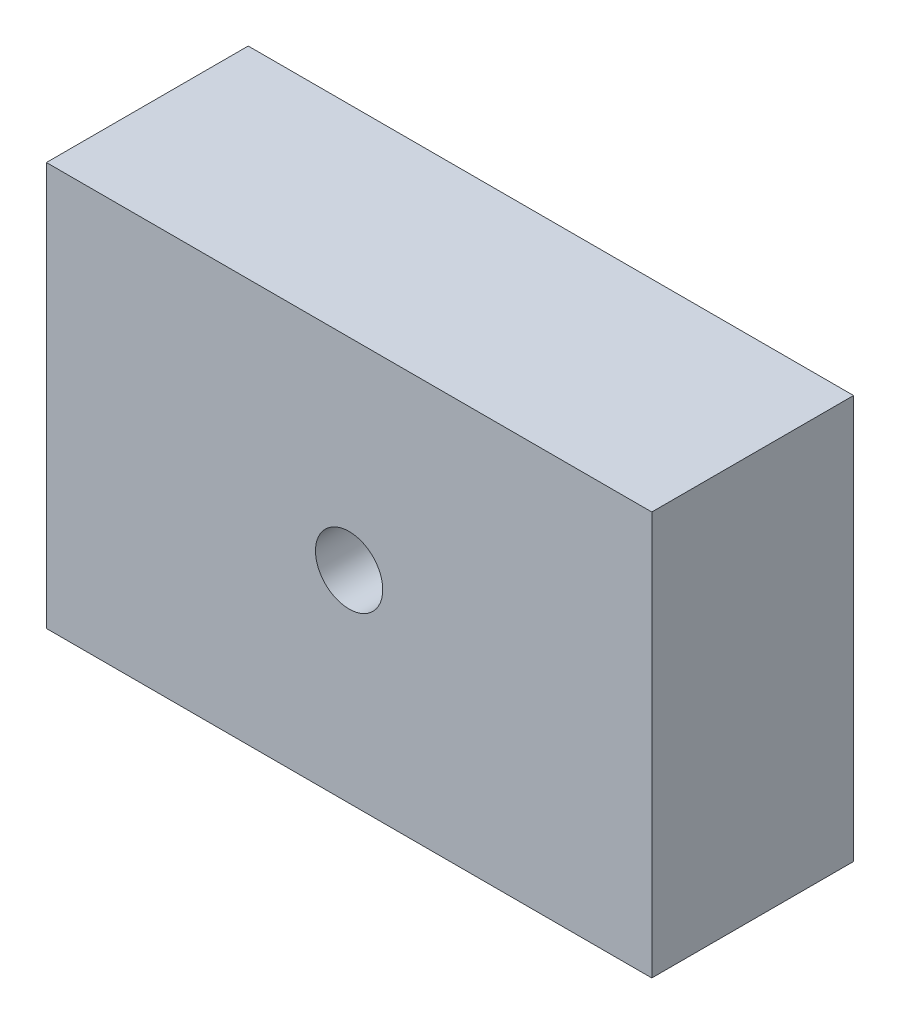
from build123d import *

# Parameters (mm, degrees)
SKETCH1_W           = 90
SKETCH1_H           = 60
BOSS_EXTRUDE1_DEPTH = 30
SKETCH2_R           = 5
CUT_EXTRUDE1_DEPTH  = 10


with BuildPart() as part:
    # Sketch1 → Boss-Extrude1 (new body)
    with BuildSketch(Plane.XY):
        with Locations((45, 30)):
            Rectangle(SKETCH1_W, SKETCH1_H)
    extrude(amount=BOSS_EXTRUDE1_DEPTH)

    # Sketch2 → Cut-Extrude1 (cut)
    with BuildSketch(Plane.XY.offset(30)):
        with Locations((45, 30)):
            Circle(SKETCH2_R)
    extrude(amount=-CUT_EXTRUDE1_DEPTH, mode=Mode.SUBTRACT)


solid = part.part
